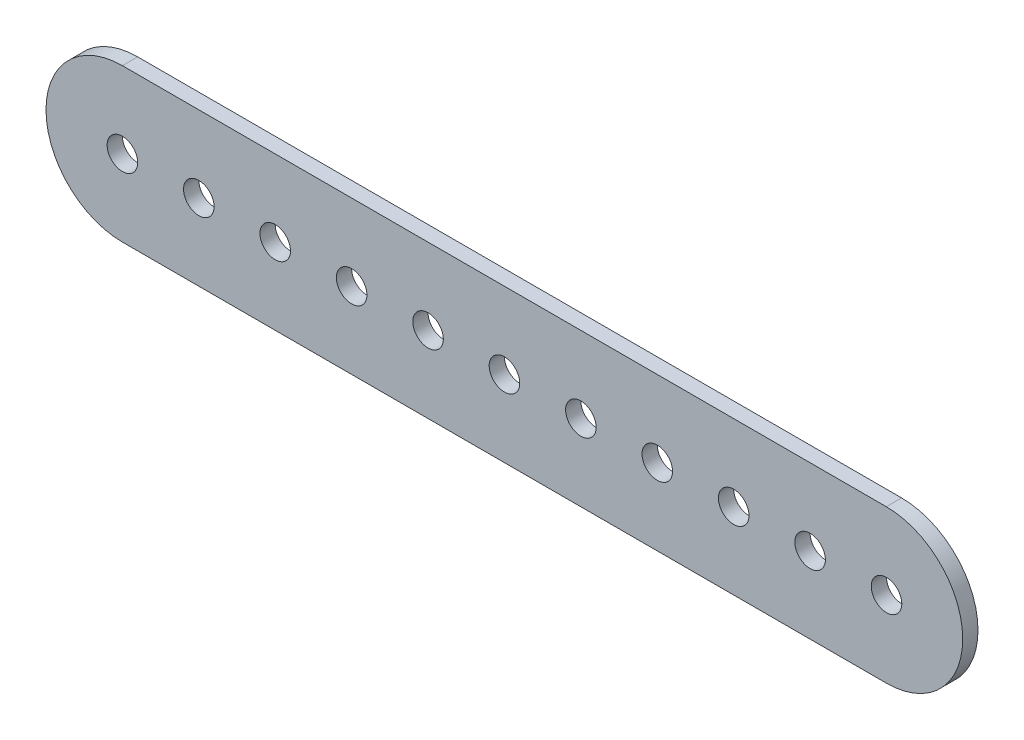
from build123d import *

# Parameters (mm, degrees)
SKETCH2_R           = 100
BOSS_EXTRUDE2_DEPTH = 100


with BuildPart() as part:
    # Sketch2 → Boss-Extrude2 (new body)
    with BuildSketch(Plane.XY):
        with BuildLine():
            Line((0, 500), (5000, 500))
            ThreePointArc((5000, 500), (5500, 0), (5000, -500))
            Line((5000, -500), (0, -500))
            ThreePointArc((0, -500), (-500, 0), (0, 500))
        make_face()
        Circle(SKETCH2_R, mode=Mode.SUBTRACT)
        with Locations((500.126, 0)):
            Circle(SKETCH2_R, mode=Mode.SUBTRACT)
        with Locations((1000.252, 0)):
            Circle(SKETCH2_R, mode=Mode.SUBTRACT)
        with Locations((1500.378, 0)):
            Circle(SKETCH2_R, mode=Mode.SUBTRACT)
        with Locations((2000.504, 0)):
            Circle(SKETCH2_R, mode=Mode.SUBTRACT)
        with Locations((2500.63, 0)):
            Circle(SKETCH2_R, mode=Mode.SUBTRACT)
        with Locations((3000.756, 0)):
            Circle(SKETCH2_R, mode=Mode.SUBTRACT)
        with Locations((3500.882, 0)):
            Circle(SKETCH2_R, mode=Mode.SUBTRACT)
        with Locations((4001.008, 0)):
            Circle(SKETCH2_R, mode=Mode.SUBTRACT)
        with Locations((4501.134, 0)):
            Circle(SKETCH2_R, mode=Mode.SUBTRACT)
        with Locations((5001.26, 0)):
            Circle(SKETCH2_R, mode=Mode.SUBTRACT)
    extrude(amount=BOSS_EXTRUDE2_DEPTH)


solid = part.part
